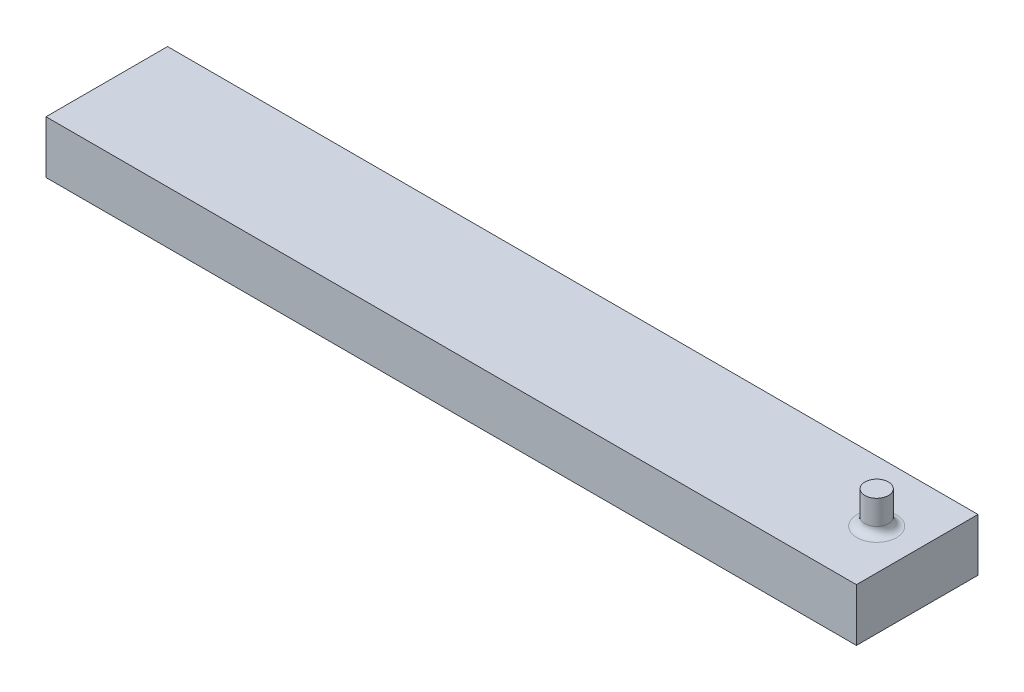
from build123d import *

# Parameters (mm, degrees)
SKETCH2_W           = 100
SKETCH2_H           = 15
BOSS_EXTRUDE1_DEPTH = 3.25
SKETCH4_R           = 1.45
BOSS_EXTRUDE2_DEPTH = 4
SKETCH5_R           = 5.1
CUT_EXTRUDE1_DEPTH  = 4
FILLET1_R           = 1
SKETCH6_W           = 8.5
SKETCH6_H           = 4
SKETCH6_W_2         = 5
SKETCH6_H_2         = 3.25
CUT_EXTRUDE3_DEPTH  = 1.125


with BuildPart() as part:
    # Sketch2 → Boss-Extrude1 (new, symmetric)
    with BuildSketch(Plane(origin=(0, 0, 0), x_dir=(1, 0, 0), z_dir=(0, 1, 0))):
        Rectangle(SKETCH2_W, SKETCH2_H)
    extrude(amount=BOSS_EXTRUDE1_DEPTH, both=True)

    # Sketch4 → Boss-Extrude2 (add)
    with BuildSketch(Plane(origin=(0, 3.25, 0), x_dir=(1, 0, 0), z_dir=(0, 1, 0))):
        with Locations(Location((45, 0, 0), (0, 0, 90))):
            Circle(SKETCH4_R)
    extrude(amount=BOSS_EXTRUDE2_DEPTH)

    # Sketch5 → Cut-Extrude1 (cut)
    with BuildSketch(Plane(origin=(0, -3.25, 0), x_dir=(-1, 0, 0), z_dir=(0, -1, 0))):
        with Locations(Location((40, 0, 0), (0, 0, 90))):
            Circle(SKETCH5_R)
    extrude(amount=-CUT_EXTRUDE1_DEPTH, mode=Mode.SUBTRACT)

    # Fillet1
    fillet1_edges = [part.edges().sort_by_distance(p)[0] for p in [
        (45, 3.25, 1.45),
    ]]
    fillet(fillet1_edges, radius=FILLET1_R)

    # Sketch6 → Cut-Extrude3 (cut, symmetric)
    with BuildSketch(Plane.XY):
        with Locations((-19.25, -1.25)):
            Rectangle(SKETCH6_W, SKETCH6_H)
        with Locations((-12.5, -0.875)):
            Rectangle(SKETCH6_W_2, SKETCH6_H_2)
    extrude(amount=CUT_EXTRUDE3_DEPTH, both=True, mode=Mode.SUBTRACT)


solid = part.part
